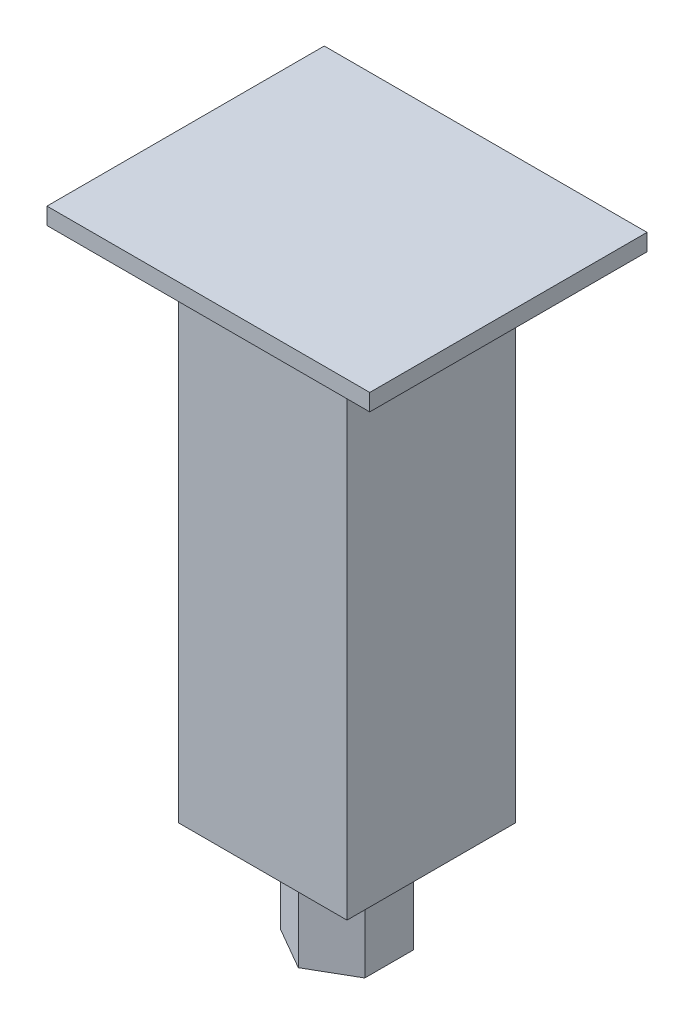
from build123d import *

# Parameters (mm, degrees)
BOSS_EXTRUDE1_DEPTH = 12
SKETCH2_W           = 20
SKETCH2_H           = 20
BOSS_EXTRUDE2_DEPTH = 60
SKETCH3_W           = 38.284232122
SKETCH3_H           = 32.888854422
BOSS_EXTRUDE3_DEPTH = 2


with BuildPart() as part:
    # Sketch1 → Boss-Extrude1 (new body)
    with BuildSketch(Plane(origin=(0, 0, 0), x_dir=(1, 0, 0), z_dir=(0, 1, 0))):
        Polygon((0, 5.773502692), (-5, 2.886751346), (-5, -2.886751346), (0, -5.773502692), (5, -2.886751346), (5, 2.886751346), align=None)
    extrude(amount=BOSS_EXTRUDE1_DEPTH)

    # Sketch2 → Boss-Extrude2 (add)
    with BuildSketch(Plane(origin=(0, 12, 0), x_dir=(1, 0, 0), z_dir=(0, 1, 0))):
        Rectangle(SKETCH2_W, SKETCH2_H)
    extrude(amount=BOSS_EXTRUDE2_DEPTH)

    # Sketch3 → Boss-Extrude3 (add)
    with BuildSketch(Plane(origin=(0, 72, 0), x_dir=(1, 0, 0), z_dir=(0, 1, 0))):
        Rectangle(SKETCH3_W, SKETCH3_H)
    extrude(amount=BOSS_EXTRUDE3_DEPTH)


solid = part.part
